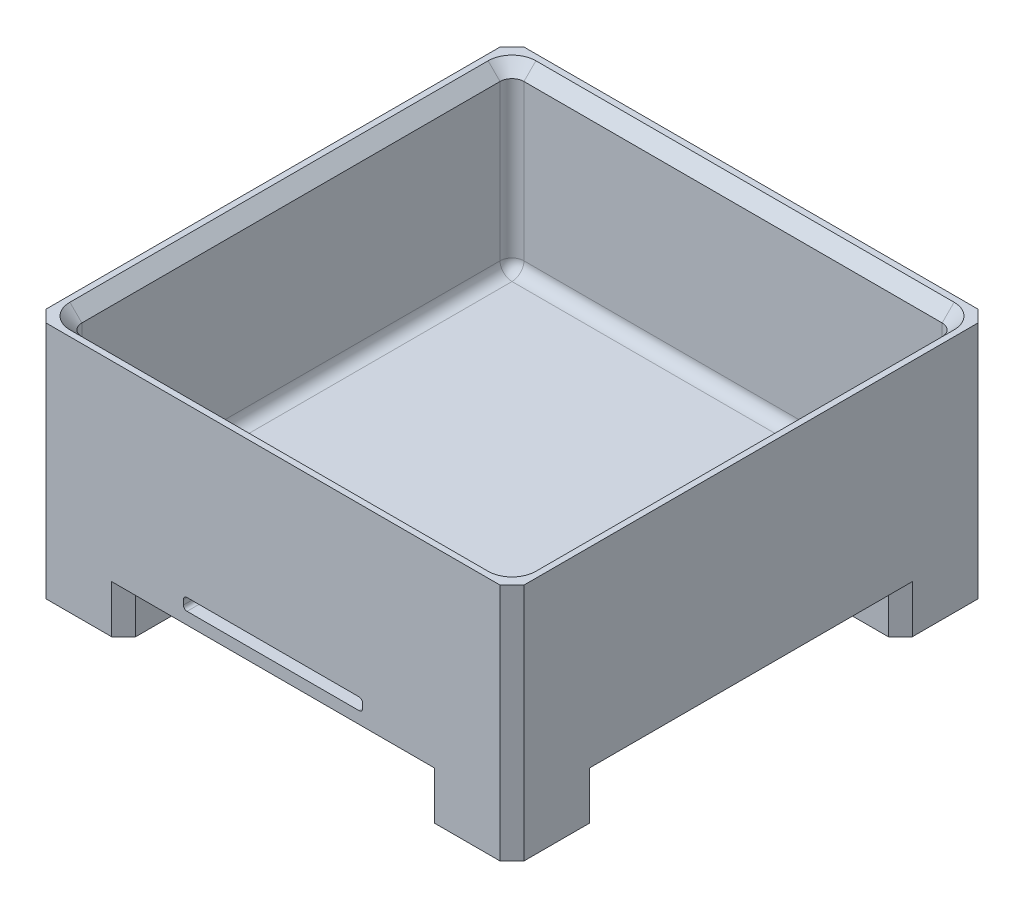
from build123d import *

# Parameters (mm, degrees)
SKETCH1_W           = 400
SKETCH1_H           = 400
BOSS_EXTRUDE1_DEPTH = 200
SKETCH2_W           = 370
SKETCH2_H           = 370
CUT_EXTRUDE1_DEPTH  = 150
FILLET1_R           = 10
CHAMFER1_SIZE       = 10
CUT_EXTRUDE2_REACH  = 491.898
CUT_EXTRUDE3_DEPTH  = 40


with BuildPart() as part:
    # Sketch1 → Boss-Extrude1 (new body)
    with BuildSketch(Plane(origin=(0, 0, 0), x_dir=(1, 0, 0), z_dir=(0, 1, 0))):
        Rectangle(SKETCH1_W, SKETCH1_H)
    extrude(amount=BOSS_EXTRUDE1_DEPTH)

    # Sketch2 → Cut-Extrude1 (cut)
    with BuildSketch(Plane(origin=(0, 200, 0), x_dir=(1, 0, 0), z_dir=(0, 1, 0))):
        Rectangle(SKETCH2_W, SKETCH2_H)
    extrude(amount=-CUT_EXTRUDE1_DEPTH, mode=Mode.SUBTRACT)

    # Fillet1
    fillet1_edges = [part.edges().sort_by_distance(p)[0] for p in [
        (-185, 50, 0),
        (-185, 125, 185),
        (0, 50, -185),
        (-185, 125, -185),
        (185, 50, 0),
        (185, 125, -185),
        (0, 50, 185),
        (185, 125, 185),
    ]]
    fillet(fillet1_edges, radius=FILLET1_R)

    # Chamfer1
    chamfer1_edges = [part.edges().sort_by_distance(p)[0] for p in [
        (0, 200, -185),
        (185, 200, 0),
        (0, 200, 185),
        (-185, 200, 0),
        (182.071067812, 200, 182.071067812),
        (-182.071067812, 200, 182.071067812),
        (182.071067812, 200, -182.071067812),
        (-182.071067812, 200, -182.071067812),
        (-200, 100, -200),
        (200, 100, -200),
        (200, 100, 200),
        (-200, 100, 200),
    ]]
    chamfer(chamfer1_edges, length=CHAMFER1_SIZE)

    # Sketch3 → Cut-Extrude2 (cut, up to next)
    with BuildSketch(Plane.XY.offset(200), mode=Mode.PRIVATE) as cut_extrude2_sk1:
        with BuildLine():
            Line((-72, 60), (72, 60))
            ThreePointArc((72, 60), (74.121320344, 59.121320344), (75, 57))
            Line((75, 57), (75, 53))
            ThreePointArc((75, 53), (74.121320344, 50.878679656), (72, 50))
            Line((72, 50), (-72, 50))
            ThreePointArc((-72, 50), (-74.121320344, 50.878679656), (-75, 53))
            Line((-75, 53), (-75, 57))
            ThreePointArc((-75, 57), (-74.121320344, 59.121320344), (-72, 60))
        make_face()
    cut_extrude2_tool1 = extrude(cut_extrude2_sk1.sketch, amount=-CUT_EXTRUDE2_REACH, mode=Mode.PRIVATE) & part.part
    add(cut_extrude2_tool1.solids().sort_by_distance((0, 55, 200))[0], mode=Mode.SUBTRACT)

    # Sketch4 → Cut-Extrude3 (cut)
    with BuildSketch(Plane.XZ):
        Polygon((190, 125), (135, 125), (125, 135), (125, 190), (135, 200), (-135, 200), (-125, 190), (-125, 135), (-135, 125), (-190, 125), (-200, 135), (-200, -135), (-190, -125), (-135, -125), (-125, -135), (-125, -190), (-135, -200), (135, -200), (125, -190), (125, -135), (135, -125), (190, -125), (200, -135), (200, 135), align=None)
    extrude(amount=-CUT_EXTRUDE3_DEPTH, mode=Mode.SUBTRACT)


solid = part.part
